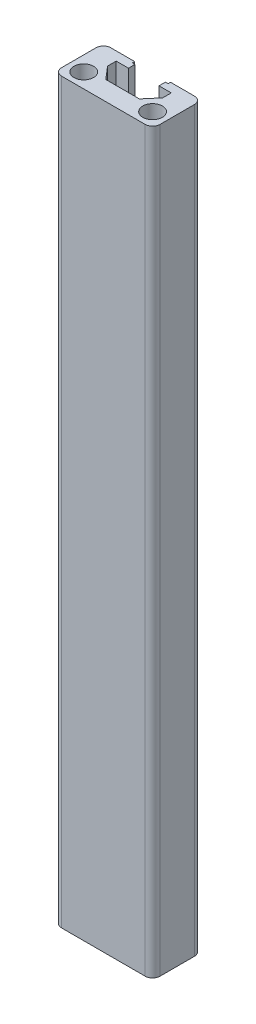
from build123d import *

# Parameters (mm, degrees)
SKETCH_1_R      = 2
EXTRUDE_1_DEPTH = 150
FILLET_1_R      = 1.5


with BuildPart() as part:
    # 草图1 → 凸台-拉伸1 (new body)
    with BuildSketch(Plane(origin=(0, 0, 0), x_dir=(1, 0, 0), z_dir=(0, 1, 0))):
        Polygon((0, 0), (20, 0), (20, 10), (13.65, 10), (13.65, 9.510427602), (13.1, 9.510427602), (13.1, 8.2), (15.6, 8.2), (15.6, 6.447507136), (13.412706863, 3.9), (6.587293137, 3.9), (4.4, 6.447507136), (4.4, 8.2), (6.9, 8.2), (6.9, 9.510427602), (6.35, 9.510427602), (6.35, 10), (0, 10), align=None)
        with Locations(Location((3, 3, 0), (0, 0, 270))):
            Circle(SKETCH_1_R, mode=Mode.SUBTRACT)
        with Locations(Location((17, 3, 0), (0, 0, 270))):
            Circle(SKETCH_1_R, mode=Mode.SUBTRACT)
    extrude(amount=EXTRUDE_1_DEPTH)

    # 圆角1
    fillet_1_edges = [part.edges().sort_by_distance(p)[0] for p in [
        (0, 75, -10),
        (20, 75, -10),
        (20, 75, 0),
        (0, 75, 0),
    ]]
    fillet(fillet_1_edges, radius=FILLET_1_R)


solid = part.part
